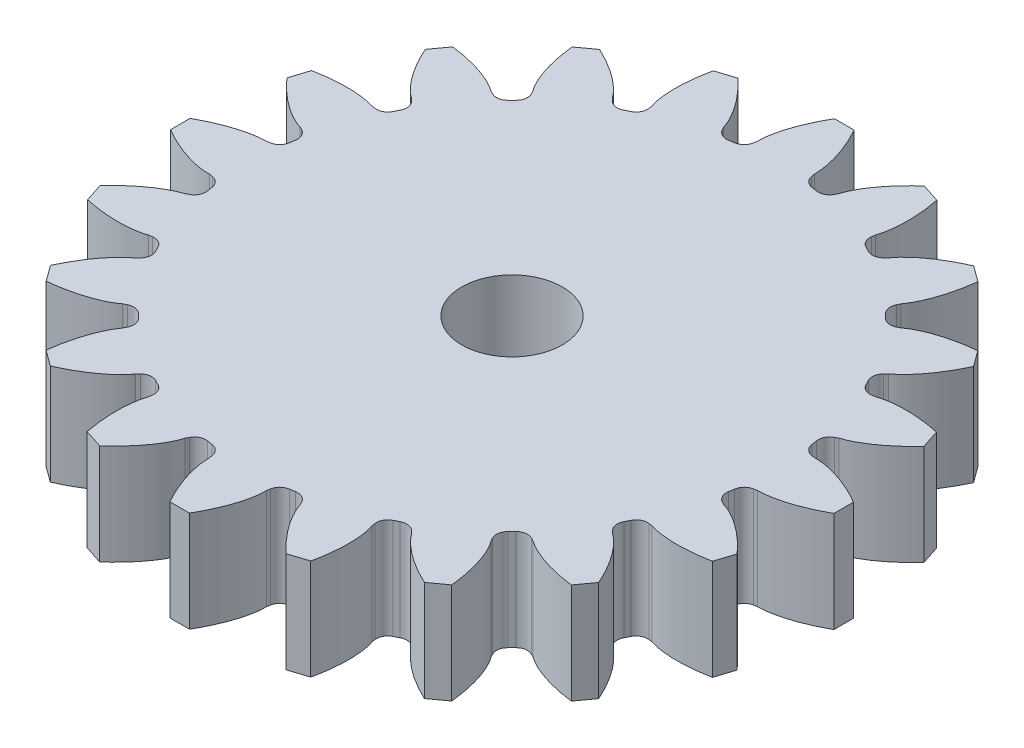
from build123d import *

# Parameters (mm, degrees)
BOSS_EXTRUDE1_DEPTH      = 5
BOSS_EXTRUDE2_DEPTH      = 5
FILLET2_R                = 0.57
CIRPATTERN5_COUNT        = 20
FILLET2_OF_CIRPATTERN5_R = 0.57
CUT_EXTRUDE1_REACH       = 25.864
SKETCH2_R                = 2.5


with BuildPart() as part:
    # Sketch1 → Boss-Extrude1 (new body)
    with BuildSketch(Plane(origin=(0, 0, 0), x_dir=(1, 0, 0), z_dir=(0, 1, 0))):
        with BuildLine():
            ThreePointArc((1.516030514, 13.03714986), (0, 13.125), (-1.516030514, 13.03714986))
            ThreePointArc((-1.516030514, 13.03714986), (-8.72833674, -9.802130521), (13.125, 0))
            ThreePointArc((13.125, 0), (9.802130521, 8.72833674), (1.516030514, 13.03714986))
        make_face()
    extrude(amount=BOSS_EXTRUDE1_DEPTH)

    # Sketch1<4> → Boss-Extrude2 (add)
    with BuildSketch(Plane(origin=(0, 0, 0), x_dir=(1, 0, 0), z_dir=(0, 1, 0))):
        with BuildLine():
            Line((0.504038283, 16.5), (-0.468558994, 16.5))
            add(Edge.make_bspline(
                [(-1.412919904, 13.621919187), (-1.413353418, 13.626428777), (-1.414380473, 13.639095255), (-1.415576073, 13.663110205), (-1.416465583, 13.702372184), (-1.416038036, 13.752492456), (-1.413691734, 13.817350014), (-1.408620575, 13.893820805), (-1.400630474, 13.977892196), (-1.38933052, 14.069352492), (-1.375753037, 14.160560857), (-1.360066425, 14.251481884), (-1.342508923, 14.341976612), (-1.318962625, 14.451471667), (-1.287562466, 14.582575023), (-1.246260389, 14.735450618), (-1.193997302, 14.908340337), (-1.134960368, 15.083899172), (-1.072131481, 15.256080659), (-1.003234229, 15.429280961), (-0.932735179, 15.596310846), (-0.853998385, 15.768884517), (-0.778513736, 15.927720606), (-0.687887777, 16.104531338), (-0.612980747, 16.246893256), (-0.530584104, 16.392914488), (-0.489741358, 16.463828612), (-0.468558994, 16.5)],
                knots=[0, 0, 0, 0, 0, 0.005376749, 0.015083688, 0.02853182, 0.04661014, 0.064854849, 0.092110526, 0.119476176, 0.146842496, 0.174208854, 0.201574956, 0.228941013, 0.256307345, 0.307035032, 0.361767352, 0.416499661, 0.471231937, 0.525964282, 0.580696616, 0.635428982, 0.690161387, 0.744893688, 0.799626082, 0.854358408, 0.909086915, 0.909086915, 0.909086915, 0.909086915, 0.909086915], degree=4))
            Line((-1.412919904, 13.621919187), (-1.516030514, 13.03714986))
            ThreePointArc((-1.516030514, 13.03714986), (0, 13.125), (1.516030514, 13.03714986))
            Line((1.516030514, 13.03714986), (1.412919904, 13.621919187))
            add(Edge.make_bspline(
                [(1.412919904, 13.621919187), (1.413035197, 13.635860862), (1.412937323, 13.663715167), (1.411942742, 13.727083878), (1.408244358, 13.797045266), (1.402017235, 13.886135964), (1.392697895, 13.976048896), (1.380968688, 14.071134922), (1.367142253, 14.163646455), (1.35136027, 14.257207263), (1.333809066, 14.34960164), (1.314388373, 14.442640884), (1.288243283, 14.55785729), (1.253517324, 14.695962453), (1.209353886, 14.854856575), (1.152868855, 15.036048206), (1.092736375, 15.213330413), (1.0260224, 15.392562593), (0.95818015, 15.564349289), (0.880995478, 15.743887347), (0.808535393, 15.906204587), (0.718159782, 16.092362201), (0.647776686, 16.234431396), (0.563183124, 16.392326615), (0.52435499, 16.463442706), (0.504038283, 16.5)],
                knots=[0.02486085, 0.02486085, 0.02486085, 0.02486085, 0.02486085, 0.043163466, 0.061467036, 0.087192535, 0.1146477, 0.142103294, 0.169558209, 0.197013723, 0.224468834, 0.251924133, 0.279379415, 0.30733553, 0.362246015, 0.417156511, 0.47206699, 0.52697758, 0.581888046, 0.636798446, 0.691708918, 0.746619439, 0.80152989, 0.856440436, 0.91134496, 0.91134496, 0.91134496, 0.91134496, 0.91134496], degree=4))
        make_face()
    boss_extrude2 = extrude(amount=BOSS_EXTRUDE2_DEPTH)

    # Fillet2
    fillet2_edges = [part.edges().sort_by_distance(p)[0] for p in [
        (-1.516030514, 2.5, -13.03714986),
        (1.516030514, 2.5, -13.03714986),
    ]]
    fillet(fillet2_edges, radius=FILLET2_R)

    # CirPattern5: Boss-Extrude2 ×20 about axis
    cirpattern5_axis = Axis((0, 5, 0), (0, 1, 0))
    for i in range(1, CIRPATTERN5_COUNT):
        add(boss_extrude2.rotate(cirpattern5_axis, i * 360 / CIRPATTERN5_COUNT))

    # Fillet2 of CirPattern5
    fillet2_of_cirpattern5_edges = [part.edges().sort_by_distance(p)[0] for p in [
        (-5.470531564, 2.5, -11.930587136),
        (-2.586870166, 2.5, -12.867545521),
        (-8.88953887, 2.5, -9.656175417),
        (-6.43654997, 2.5, -11.438376173),
        (-11.438376173, 2.5, -6.43654997),
        (-9.656175417, 2.5, -8.88953887),
        (-12.867545521, 2.5, -2.586870166),
        (-11.930587136, 2.5, -5.470531564),
        (-13.03714986, 2.5, 1.516030514),
        (-13.03714986, 2.5, -1.516030514),
        (-11.930587136, 2.5, 5.470531564),
        (-12.867545521, 2.5, 2.586870166),
        (-9.656175417, 2.5, 8.88953887),
        (-11.438376173, 2.5, 6.43654997),
        (-6.43654997, 2.5, 11.438376173),
        (-8.88953887, 2.5, 9.656175417),
        (-2.586870166, 2.5, 12.867545521),
        (-5.470531564, 2.5, 11.930587136),
        (1.516030514, 2.5, 13.03714986),
        (-1.516030514, 2.5, 13.03714986),
        (5.470531564, 2.5, 11.930587136),
        (2.586870166, 2.5, 12.867545521),
        (8.88953887, 2.5, 9.656175417),
        (6.43654997, 2.5, 11.438376173),
        (11.438376173, 2.5, 6.43654997),
        (9.656175417, 2.5, 8.88953887),
        (12.867545521, 2.5, 2.586870166),
        (11.930587136, 2.5, 5.470531564),
        (13.03714986, 2.5, -1.516030514),
        (13.03714986, 2.5, 1.516030514),
        (11.930587136, 2.5, -5.470531564),
        (12.867545521, 2.5, -2.586870166),
        (9.656175417, 2.5, -8.88953887),
        (11.438376173, 2.5, -6.43654997),
        (6.43654997, 2.5, -11.438376173),
        (8.88953887, 2.5, -9.656175417),
        (2.586870166, 2.5, -12.867545521),
        (5.470531564, 2.5, -11.930587136),
    ]]
    fillet(fillet2_of_cirpattern5_edges, radius=FILLET2_OF_CIRPATTERN5_R)

    # Sketch2 → Cut-Extrude1 (cut, up to next)
    with BuildSketch(Plane(origin=(0, 5, 0), x_dir=(1, 0, 0), z_dir=(0, 1, 0)), mode=Mode.PRIVATE) as cut_extrude1_sk1:
        Circle(SKETCH2_R)
    cut_extrude1_tool1 = extrude(cut_extrude1_sk1.sketch, amount=-CUT_EXTRUDE1_REACH, mode=Mode.PRIVATE) & part.part
    add(cut_extrude1_tool1.solids().sort_by_distance((0, 5, 0))[0], mode=Mode.SUBTRACT)


solid = part.part
